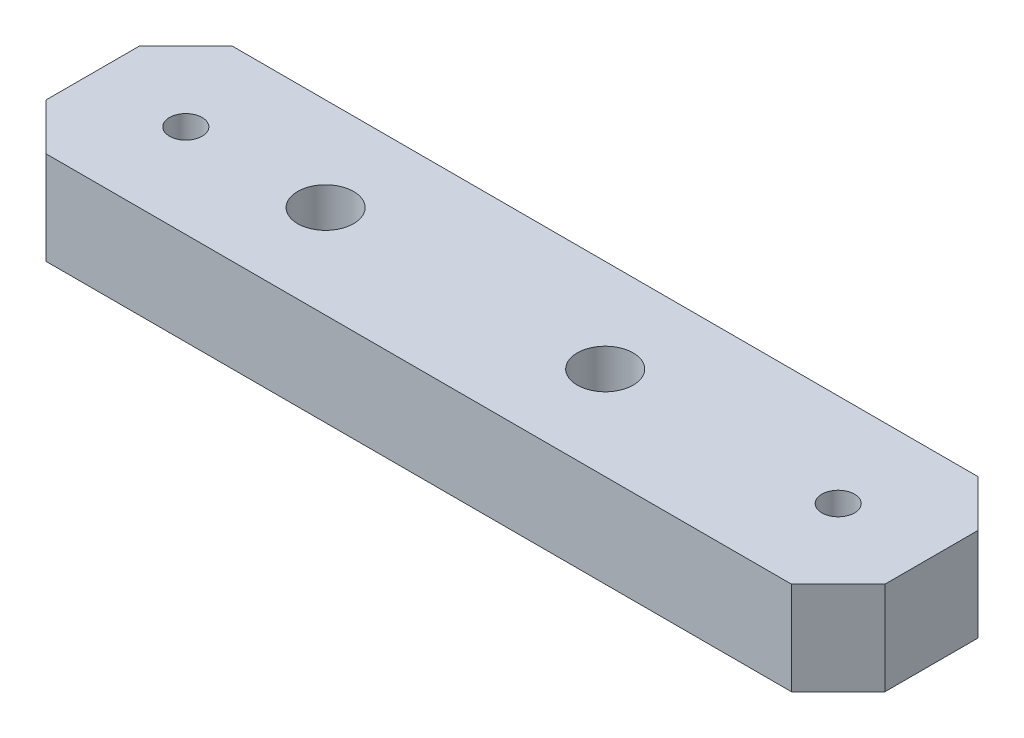
from build123d import *

# Parameters (mm, degrees)
SKETCH1_W           = 90
SKETCH1_H           = 20
SKETCH1_R           = 1.75
SKETCH1_R_2         = 3
BOSS_EXTRUDE1_DEPTH = 10
CHAMFER1_SIZE       = 5


with BuildPart() as part:
    # Sketch1 → Boss-Extrude1 (new body)
    with BuildSketch(Plane(origin=(0, 0, 0), x_dir=(1, 0, 0), z_dir=(0, 1, 0))):
        with Locations((35, 0)):
            Rectangle(SKETCH1_W, SKETCH1_H)
        with Locations(Location((0, 0, 0), (0, 0, 270))):
            Circle(SKETCH1_R, mode=Mode.SUBTRACT)
        with Locations(Location((70, 0, 0), (0, 0, 270))):
            Circle(SKETCH1_R, mode=Mode.SUBTRACT)
        with Locations(Location((15, 0, 0), (0, 0, 270))):
            Circle(SKETCH1_R_2, mode=Mode.SUBTRACT)
        with Locations(Location((45, 0, 0), (0, 0, 270))):
            Circle(SKETCH1_R_2, mode=Mode.SUBTRACT)
    extrude(amount=BOSS_EXTRUDE1_DEPTH)

    # Chamfer1
    chamfer1_edges = [part.edges().sort_by_distance(p)[0] for p in [
        (-10, 5, -10),
        (80, 5, -10),
        (80, 5, 10),
        (-10, 5, 10),
    ]]
    chamfer(chamfer1_edges, length=CHAMFER1_SIZE)


solid = part.part
